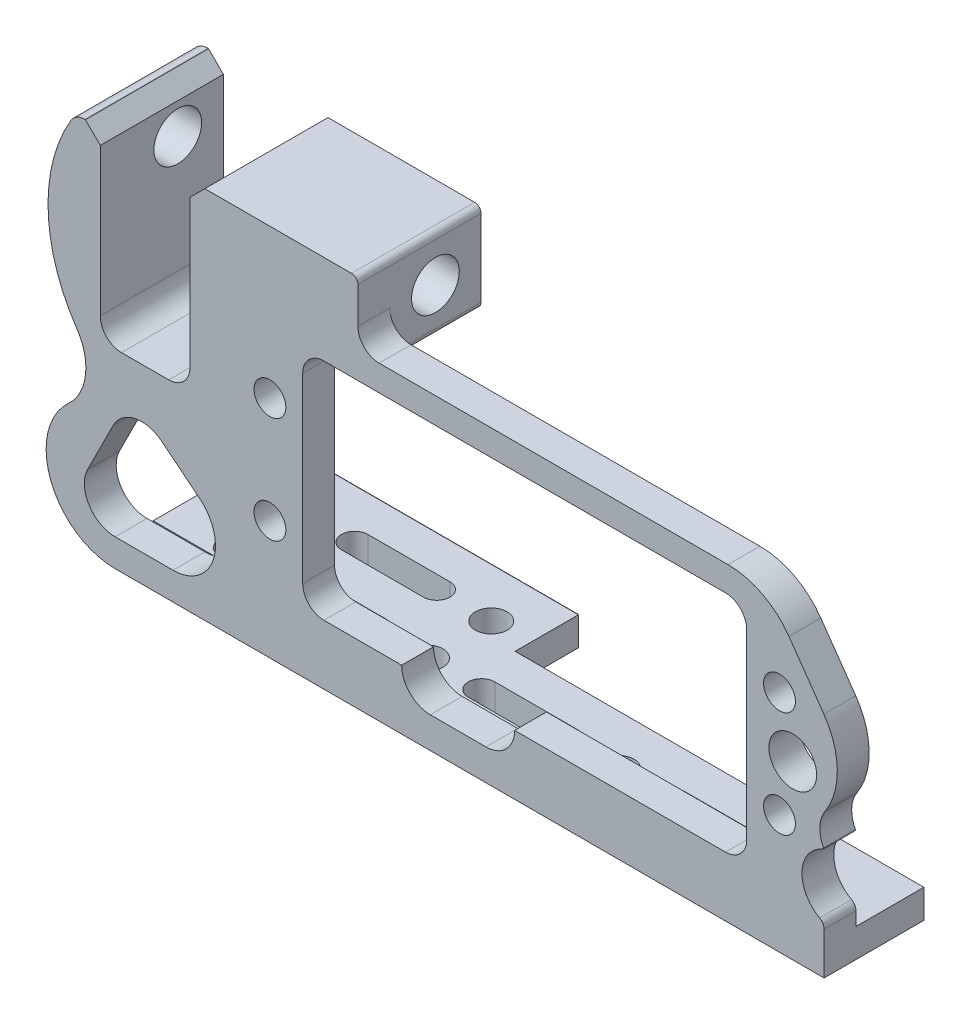
from build123d import *

# Parameters (mm, degrees)
EXTRUDE_1_DEPTH             = 15.45
CUT_EXTRUDE_START           = -3
CUT_EXTRUDE_1_DEPTH         = 3
CUT_EXTRUDE_2_DEPTH         = 3.85
SKETCH_4_W                  = 41.82
SKETCH_4_H                  = 11.6
CUT_EXTRUDE_3_DEPTH         = 21.15
CUT_EXTRUDE_4_DEPTH         = 8.6
CUT_EXTRUDE_5_DEPTH         = 1.8
CUT_EXTRUDE_6_DEPTH         = 55.864666488
SKETCH_8_W                  = 38.5
SKETCH_8_H                  = 6.05
CUT_EXTRUDE_7_DEPTH         = 54.988931771
CUT_EXTRUDE_8_DEPTH         = 56.622222437
CUT_EXTRUDE_9_DEPTH         = 53.267387096
CUT_EXTRUDE_10_DEPTH        = 53.267387096
CUT_EXTRUDE_11_DEPTH        = 53.267387096
CUT_EXTRUDE_12_REACH        = 55.989
HOLE_WIZARD_4_5_4_5_1_D     = 4.5
HOLE_WIZARD_4_5_4_5_1_DEPTH = 15.45
HOLE_WIZARD_3_0_3_1_D       = 3
HOLE_WIZARD_3_0_3_1_DEPTH   = 15.45
HOLE_WIZARD_4_5_4_5_2_D     = 4.5
HOLE_WIZARD_4_5_4_5_2_DEPTH = 15.82
HOLE_WIZARD_3_0_3_2_D       = 3
HOLE_WIZARD_3_0_3_2_DEPTH   = 35.225
HOLE_WIZARD_3_0_3_3_D       = 3
HOLE_WIZARD_3_0_3_3_DEPTH   = 2.7
HOLE_WIZARD_4_5_4_5_3_D     = 4.5
HOLE_WIZARD_4_5_4_5_3_DEPTH = 5.098707083
CHAMFER_1_SIZE              = 1.4
FILLET_1_R                  = 0.1
FILLET_2_R                  = 0.6
FILLET_3_R                  = 0.8
FILLET_4_R                  = 1.5
FILLET_5_R                  = 2
FILLET_6_R                  = 5
FILLET_7_R                  = 7


with BuildPart() as part:
    # 草图1 → 凸台-拉伸1 (new body)
    with BuildSketch(Plane(origin=(0, 0, -7.725), x_dir=(-1, 0, 0), z_dir=(0, 0, -1))):
        with BuildLine():
            Line((-33.1, 4.5), (-33.1, 0))
            Line((-33.1, 0), (33.678707095, 0))
            ThreePointArc((33.678707095, 0), (39.738830661, 4.149488914), (38.061595595, 11.300030041))
            ThreePointArc((38.061595595, 11.300030041), (36.467031228, 14.410403313), (37.299271482, 17.805168927))
            ThreePointArc((37.299271482, 17.805168927), (39.999832621, 26.502756343), (37.380000011, 35.225))
            Line((37.380000011, 35.225), (10.810000011, 35.225))
            Line((10.810000011, 35.225), (10.810000011, 29.2))
            Line((10.810000011, 29.2), (-27.699423591, 29.2))
            Line((-27.699423591, 29.2), (-33.080493977, 21.515035054))
            ThreePointArc((-33.080493977, 21.515035054), (-34.34571891, 17.599750125), (-33.192582248, 13.65))
            ThreePointArc((-33.192582248, 13.65), (-32.699371136, 12.08813551), (-33.1, 10.5))
            ThreePointArc((-33.1, 10.5), (-31.013552873, 7.5), (-33.1, 4.5))
        make_face()
        with BuildLine():
            Line((33.1, 4.5), (24.824298189, 4.5))
            ThreePointArc((24.824298189, 4.5), (24.286959437, 7.280165717), (25.72494237, 9.719481079))
            Line((25.72494237, 9.719481079), (29.300883551, 12.589610809))
            ThreePointArc((29.300883551, 12.589610809), (31.816714487, 13.181372813), (33.859031396, 11.597539106))
            Line((33.859031396, 11.597539106), (36.269687252, 6.802621136))
            ThreePointArc((36.269687252, 6.802621136), (36.14726956, 3.978093514), (33.678707095, 2.6))
            Line((33.678707095, 2.6), (33.1, 2.6))
            Line((33.1, 2.6), (33.1, 4.5))
        make_face(mode=Mode.SUBTRACT)
    extrude(amount=-EXTRUDE_1_DEPTH)

    # 草图2 → 切除-拉伸1 (cut)
    with BuildSketch(Plane.XY.offset(7.725).offset(CUT_EXTRUDE_START)):
        with BuildLine():
            Line((-33.1, 2.7), (-33.1, 2.6))
            Line((-33.1, 2.6), (-28.228707095, 2.6))
            ThreePointArc((-28.228707095, 2.6), (-26.279348226, 3.107150161), (-24.824298189, 4.5))
            Line((-24.824298189, 4.5), (-33.1, 4.5))
            Line((-33.1, 4.5), (-33.1, 2.7))
        make_face()
    extrude(amount=CUT_EXTRUDE_1_DEPTH, mode=Mode.SUBTRACT)

    # 草图3 → 切除-拉伸2 (cut)
    with BuildSketch(Plane(origin=(0, 0, -7.725), x_dir=(-1, 0, 0), z_dir=(0, 0, -1))):
        with BuildLine():
            Line((37.380000011, 35.225), (10.810000011, 35.225))
            Line((10.810000011, 35.225), (10.810000011, 29.2))
            Line((10.810000011, 29.2), (-27.699423591, 29.2))
            Line((-27.699423591, 29.2), (-33.080493977, 21.515035054))
            ThreePointArc((-33.080493977, 21.515035054), (-34.34571891, 17.599750125), (-33.192582248, 13.65))
            ThreePointArc((-33.192582248, 13.65), (-32.699371136, 12.08813551), (-33.1, 10.5))
            ThreePointArc((-33.1, 10.5), (-31.013552873, 7.5), (-33.1, 4.5))
            Line((-33.1, 4.5), (24.824298189, 4.5))
            ThreePointArc((24.824298189, 4.5), (24.286959437, 7.280165717), (25.72494237, 9.719481079))
            Line((25.72494237, 9.719481079), (29.300883551, 12.589610809))
            ThreePointArc((29.300883551, 12.589610809), (31.816714487, 13.181372813), (33.859031396, 11.597539106))
            Line((33.859031396, 11.597539106), (36.269687252, 6.802621136))
            ThreePointArc((36.269687252, 6.802621136), (36.14726956, 3.978093514), (33.678707095, 2.6))
            Line((33.678707095, 2.6), (33.1, 2.6))
            Line((33.1, 2.6), (33.1, 0))
            Line((33.1, 0), (33.678707095, 0))
            ThreePointArc((33.678707095, 0), (39.738830661, 4.149488914), (38.061595595, 11.300030041))
            ThreePointArc((38.061595595, 11.300030041), (36.467031228, 14.410403313), (37.299271482, 17.805168927))
            ThreePointArc((37.299271482, 17.805168927), (39.999832621, 26.502756343), (37.380000011, 35.225))
        make_face()
    extrude(amount=-CUT_EXTRUDE_2_DEPTH, mode=Mode.SUBTRACT)

    # 草图4 → 切除-拉伸3 (cut)
    with BuildSketch(Plane.XZ.offset(-5.625)):
        with Locations((4.899999989, 1.925)):
            Rectangle(SKETCH_4_W, SKETCH_4_H)
    extrude(amount=-CUT_EXTRUDE_3_DEPTH, mode=Mode.SUBTRACT)

    # 草图5 → 切除-拉伸4 (cut)
    with BuildSketch(Plane(origin=(0, 0, -3.875), x_dir=(-1, 0, 0), z_dir=(0, 0, -1))):
        with BuildLine():
            Line((-33.1, 4.5), (24.824298189, 4.5))
            ThreePointArc((24.824298189, 4.5), (24.286959437, 7.280165717), (25.72494237, 9.719481079))
            Line((25.72494237, 9.719481079), (29.300883551, 12.589610809))
            ThreePointArc((29.300883551, 12.589610809), (31.816714487, 13.181372813), (33.859031396, 11.597539106))
            Line((33.859031396, 11.597539106), (36.269687252, 6.802621136))
            ThreePointArc((36.269687252, 6.802621136), (36.14726956, 3.978093514), (33.678707095, 2.6))
            Line((33.678707095, 2.6), (33.1, 2.6))
            Line((33.1, 2.6), (33.1, 0))
            Line((33.1, 0), (33.678707095, 0))
            ThreePointArc((33.678707095, 0), (39.738830661, 4.149488914), (38.061595595, 11.300030041))
            ThreePointArc((38.061595595, 11.300030041), (37.027131533, 12.628487421), (36.492283434, 14.225))
            Line((36.492283434, 14.225), (31.802209215, 14.225))
            ThreePointArc((31.802209215, 14.225), (24.717013382, 18.510164876), (25.222125629, 26.775))
            Line((25.222125629, 26.775), (16.010000011, 26.775))
            Line((16.010000011, 26.775), (16.010000011, 5.625))
            Line((16.010000011, 5.625), (-25.809999989, 5.625))
            Line((-25.809999989, 5.625), (-25.809999989, 26.775))
            Line((-25.809999989, 26.775), (10.810000011, 26.775))
            Line((10.810000011, 26.775), (10.810000011, 29.2))
            Line((10.810000011, 29.2), (-27.699423591, 29.2))
            Line((-27.699423591, 29.2), (-33.080493977, 21.515035054))
            ThreePointArc((-33.080493977, 21.515035054), (-34.34571891, 17.599750125), (-33.192582248, 13.65))
            ThreePointArc((-33.192582248, 13.65), (-32.699371136, 12.08813551), (-33.1, 10.5))
            ThreePointArc((-33.1, 10.5), (-31.013552873, 7.5), (-33.1, 4.5))
        make_face()
    extrude(amount=-CUT_EXTRUDE_4_DEPTH, mode=Mode.SUBTRACT)

    # 草图6 → 切除-拉伸5 (cut)
    with BuildSketch(Plane(origin=(0, 4.5, 0), x_dir=(-1, 0, 0), z_dir=(0, 1, 0))):
        Polygon((-33.1, 4.725), (-33.1, -7.725), (33.1, -7.725), (33.1, 4.725), (27.339887653, 4.725), align=None)
    extrude(amount=-CUT_EXTRUDE_5_DEPTH, mode=Mode.SUBTRACT)

    # 草图7 → 切除-拉伸6 (cut, through all)
    with BuildSketch(Plane(origin=(0, 0, 4.725), x_dir=(-1, 0, 0), z_dir=(0, 0, -1))):
        with BuildLine():
            Line((6.690000011, 5.625), (-3.949999989, 5.625))
            ThreePointArc((-3.949999989, 5.625), (-3.159188298, 3.715811691), (-1.249999989, 2.925))
            Line((-1.249999989, 2.925), (3.990000011, 2.925))
            ThreePointArc((3.990000011, 2.925), (5.899188321, 3.715811691), (6.690000011, 5.625))
        make_face()
    extrude(amount=-CUT_EXTRUDE_6_DEPTH, mode=Mode.SUBTRACT)

    # 草图8 → 切除-拉伸7 (cut, through all)
    with BuildSketch(Plane.XZ):
        with Locations((13.85, -4.7)):
            Rectangle(SKETCH_8_W, SKETCH_8_H)
    extrude(amount=-CUT_EXTRUDE_7_DEPTH, mode=Mode.SUBTRACT)

    # 草图9 → 切除-拉伸8 (cut, through all)
    with BuildSketch(Plane.XY.offset(7.725)):
        Polygon((-26.630000011, 35.225), (-36.480000011, 35.225), (-35.080000011, 33.825), (-35.080000011, 17.925), (-26.630000011, 17.925), align=None)
    extrude(amount=-CUT_EXTRUDE_8_DEPTH, mode=Mode.SUBTRACT)

    # 草图10 → 切除-拉伸9 (cut, through all)
    with BuildSketch(Plane(origin=(0, 2.7, 0), x_dir=(-1, 0, 0), z_dir=(0, 1, 0))):
        with BuildLine():
            Line((3.865, 4.275), (-3.865, 4.275))
            ThreePointArc((-3.865, 4.275), (-5.115, 3.025), (-3.865, 1.775))
            Line((-3.865, 1.775), (3.865, 1.775))
            ThreePointArc((3.865, 1.775), (5.115, 3.025), (3.865, 4.275))
        make_face()
    extrude(amount=-CUT_EXTRUDE_9_DEPTH, mode=Mode.SUBTRACT)

    # 草图11 → 切除-拉伸10 (cut, through all)
    with BuildSketch(Plane(origin=(0, 2.7, 0), x_dir=(-1, 0, 0), z_dir=(0, 1, 0))):
        with BuildLine():
            Line((-14.135, 4.275), (-21.865, 4.275))
            ThreePointArc((-21.865, 4.275), (-23.115, 3.025), (-21.865, 1.775))
            Line((-21.865, 1.775), (-14.135, 1.775))
            ThreePointArc((-14.135, 1.775), (-12.885, 3.025), (-14.135, 4.275))
        make_face()
    extrude(amount=-CUT_EXTRUDE_10_DEPTH, mode=Mode.SUBTRACT)

    # 草图12 → 切除-拉伸11 (cut, through all)
    with BuildSketch(Plane(origin=(0, 2.7, 0), x_dir=(-1, 0, 0), z_dir=(0, 1, 0))):
        with BuildLine():
            Line((14.135, -4.275), (21.865, -4.275))
            ThreePointArc((21.865, -4.275), (23.115, -3.025), (21.865, -1.775))
            Line((21.865, -1.775), (14.135, -1.775))
            ThreePointArc((14.135, -1.775), (12.885, -3.025), (14.135, -4.275))
        make_face()
    extrude(amount=-CUT_EXTRUDE_11_DEPTH, mode=Mode.SUBTRACT)

    # 草图13 → 切除-拉伸12 (cut, up to next)
    with BuildSketch(Plane.XZ, mode=Mode.PRIVATE) as cut_extrude_12_sk1:
        with BuildLine():
            Line((-14.135, 4.275), (-21.865, 4.275))
            ThreePointArc((-21.865, 4.275), (-23.115, 3.025), (-21.865, 1.775))
            Line((-21.865, 1.775), (-14.135, 1.775))
            ThreePointArc((-14.135, 1.775), (-12.885, 3.025), (-14.135, 4.275))
        make_face()
    cut_extrude_12_tool1 = extrude(cut_extrude_12_sk1.sketch, amount=-CUT_EXTRUDE_12_REACH, mode=Mode.PRIVATE) & part.part
    add(cut_extrude_12_tool1.solids().sort_by_distance((-18, 0, 3.025))[0], mode=Mode.SUBTRACT)

    # Ø4.5 (4.5) 直径孔1
    with Locations(Plane.XY.offset(7.725)):
        with Locations((30.149999977, 16.200000001)):
            Hole(HOLE_WIZARD_4_5_4_5_1_D / 2, depth=HOLE_WIZARD_4_5_4_5_1_DEPTH)

    # Ø3.0 (3) 直径孔1
    with Locations(Plane.XY.offset(7.725)):
        with Locations((-19.1, 11.2), (28.9, 11.200000001), (-19.1, 21.2), (28.899999977, 21.200000001)):
            Hole(HOLE_WIZARD_3_0_3_1_D / 2, depth=HOLE_WIZARD_3_0_3_1_DEPTH)

    # Ø4.5 (4.5) 直径孔2
    with Locations(Plane(origin=(-10.810000011, 0, 0), x_dir=(0, 0, -1), z_dir=(1, 0, 0))):
        with Locations((-0.425, 30.925)):
            Hole(HOLE_WIZARD_4_5_4_5_2_D / 2, depth=HOLE_WIZARD_4_5_4_5_2_DEPTH)

    # Ø3.0 (3) 直径孔2
    with Locations(Plane(origin=(0, 0, 0), x_dir=(-1, 0, 0), z_dir=(0, -1, 0))):
        with Locations((-9, -3.025), (9, -3.025), (9, 3.025), (-27, -3.025)):
            Hole(HOLE_WIZARD_3_0_3_2_D / 2, depth=HOLE_WIZARD_3_0_3_2_DEPTH)

    # Ø3.0 (3) 直径孔3
    with Locations(Plane(origin=(0, 0, 0), x_dir=(-1, 0, 0), z_dir=(0, -1, 0))):
        with Locations((27, -3.025), (27, 3.025)):
            Hole(HOLE_WIZARD_3_0_3_3_D / 2, depth=HOLE_WIZARD_3_0_3_3_DEPTH)

    # Ø4.5 (4.5) 直径孔3
    with Locations(Plane(origin=(-35.080000011, 0, 0), x_dir=(0, 0, -1), z_dir=(1, 0, 0))):
        with Locations((-0.425, 30.925)):
            Hole(HOLE_WIZARD_4_5_4_5_3_D / 2, depth=HOLE_WIZARD_4_5_4_5_3_DEPTH)

    # 倒角1
    chamfer_1_edges = [part.edges().sort_by_distance(p)[0] for p in [
        (-26.630000011, 35.225, 1.925),
    ]]
    chamfer(chamfer_1_edges, length=CHAMFER_1_SIZE)

    # 圆角1
    fillet_1_edges = [part.edges().sort_by_distance(p)[0] for p in [
        (33.1, 10.5, 6.225),
        (-33.1, 1.35, -7.725),
        (-19.25, 2.7, -7.725),
        (-19.25, 0, -7.725),
        (-5.4, 1.35, -7.725),
    ]]
    fillet(fillet_1_edges, radius=FILLET_1_R)

    # 圆角2
    fillet_2_edges = [part.edges().sort_by_distance(p)[0] for p in [
        (-10.810000011, 26.775, 0.425),
        (-36.492283434, 14.225, 0.425),
        (-10.810000011, 35.225, 1.925),
    ]]
    fillet(fillet_2_edges, radius=FILLET_2_R)

    # 圆角3
    fillet_3_edges = [part.edges().sort_by_distance(p)[0] for p in [
        (33.1, 4.5, 6.225),
    ]]
    fillet(fillet_3_edges, radius=FILLET_3_R)

    # 圆角4
    fillet_4_edges = [part.edges().sort_by_distance(p)[0] for p in [
        (-37.380000011, 35.225, 1.925),
    ]]
    fillet(fillet_4_edges, radius=FILLET_4_R)

    # 圆角5
    fillet_5_edges = [part.edges().sort_by_distance(p)[0] for p in [
        (-16.010000011, 26.775, 6.225),
        (-16.010000011, 5.625, 6.225),
        (25.809999989, 5.625, 6.225),
        (25.809999989, 26.775, 6.225),
        (-10.810000011, 29.2, 6.225),
        (-26.630000011, 17.925, 1.925),
        (-35.080000011, 17.925, 1.925),
    ]]
    fillet(fillet_5_edges, radius=FILLET_5_R)

    # 圆角6
    fillet_6_edges = [part.edges().sort_by_distance(p)[0] for p in [
        (-25.222125629, 26.775, 0.425),
    ]]
    fillet(fillet_6_edges, radius=FILLET_6_R)

    # 圆角7
    fillet_7_edges = [part.edges().sort_by_distance(p)[0] for p in [
        (27.699423591, 29.2, 6.225),
    ]]
    fillet(fillet_7_edges, radius=FILLET_7_R)


solid = part.part
